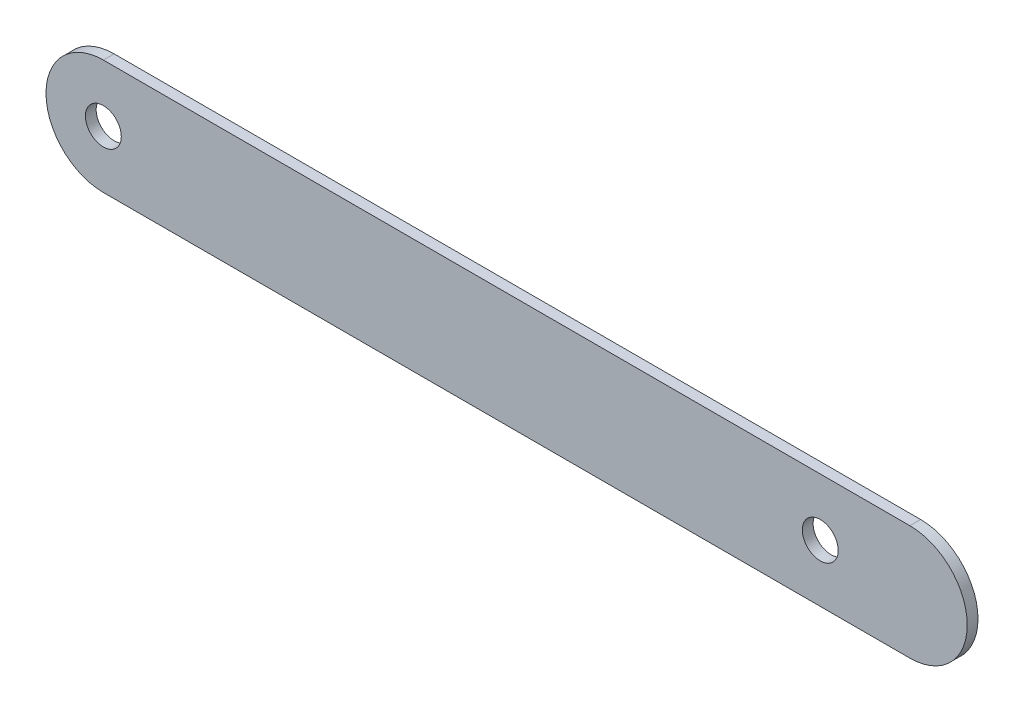
from build123d import *

# Parameters (mm, degrees)
SKETCH_1_R      = 5
EXTRUDE_1_DEPTH = 3


with BuildPart() as part:
    # 草图1 → 凸台-拉伸1 (new body)
    with BuildSketch(Plane.XY):
        with BuildLine():
            Line((0, 16), (225, 16))
            ThreePointArc((225, 16), (241, 0), (225, -16))
            Line((225, -16), (0, -16))
            ThreePointArc((0, -16), (-16, 0), (0, 16))
        make_face()
        Circle(SKETCH_1_R, mode=Mode.SUBTRACT)
        with Locations((200, 0)):
            Circle(SKETCH_1_R, mode=Mode.SUBTRACT)
    extrude(amount=EXTRUDE_1_DEPTH)


solid = part.part
